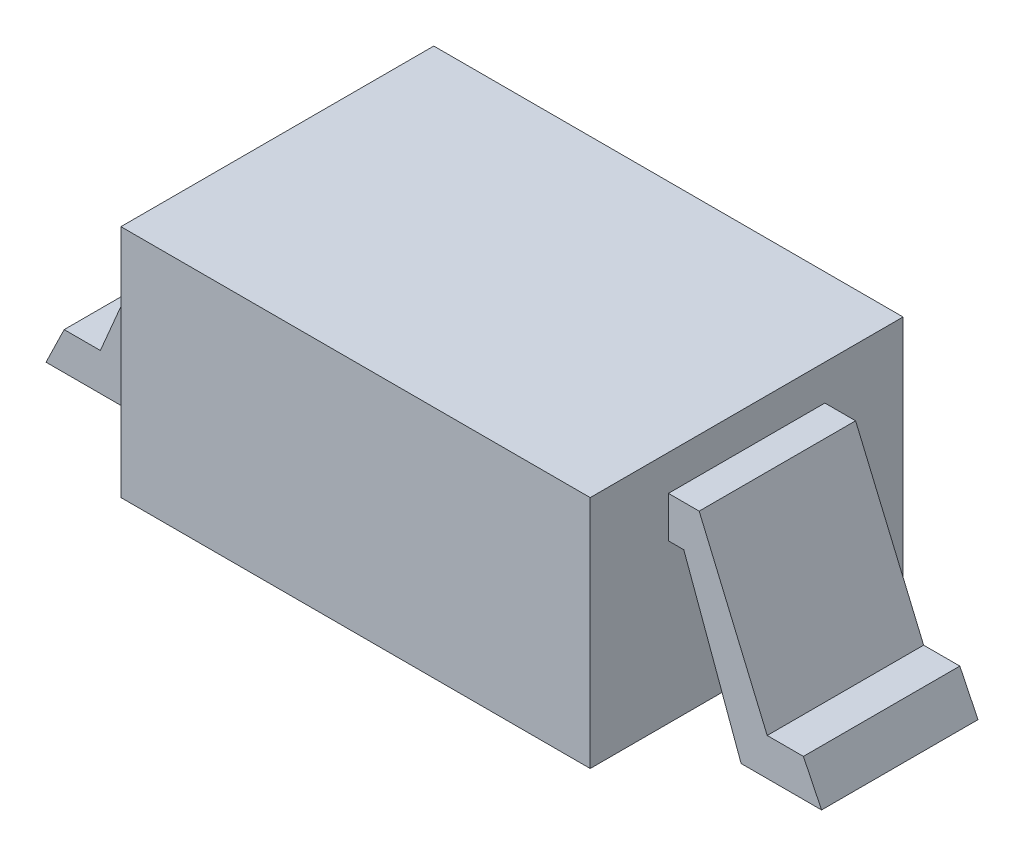
from build123d import *

# Parameters (mm, degrees)
SKETCH_1_W      = 6
SKETCH_1_H      = 3
EXTRUDE_1_DEPTH = 4
EXTRUDE_2_DEPTH = 1


with BuildPart() as part:
    # 草图1 → 凸台-拉伸1 (new body)
    with BuildSketch(Plane.XY):
        with Locations((3, -1.5)):
            Rectangle(SKETCH_1_W, SKETCH_1_H)
    extrude(amount=EXTRUDE_1_DEPTH)

    # 草图2 → 凸台-拉伸2 (add, symmetric)
    with BuildSketch(Plane.XY.offset(2)):
        Polygon((0, -0.453225327), (-0.392993769, -0.453225327), (-1.262945453, -2.502630735), (-1.725619725, -2.502630735), (-1.958016745, -2.979922814), (-1.262945453, -2.979922814), (-0.92927242, -2.979922814), (-0.196496885, -0.979190926), (0, -0.979190926), align=None)
        Polygon((7.725619725, -2.502630735), (7.958016745, -2.979922814), (7.262945453, -2.979922814), (6.92927242, -2.979922814), (6.196496885, -0.979190926), (6, -0.979190926), (6, -0.453225327), (6.392993769, -0.453225327), (7.262945453, -2.502630735), align=None)
    extrude(amount=EXTRUDE_2_DEPTH, both=True)


solid = part.part
